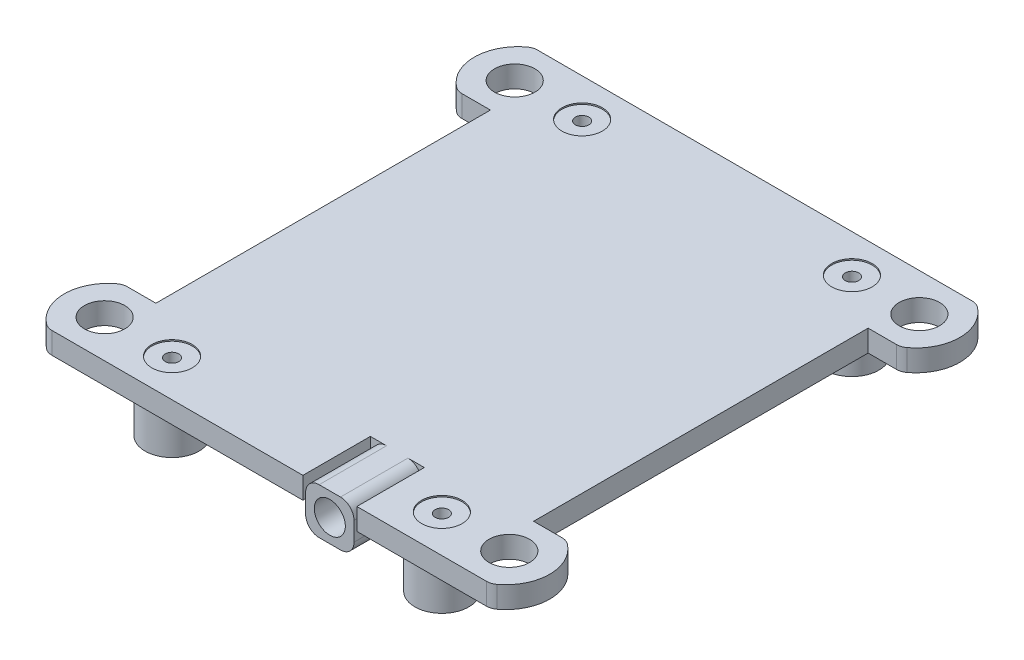
from build123d import *

# Parameters (mm, degrees)
SKETCH1_R            = 1.5
SKETCH1_R_2          = 0.5
BOSS_EXTRUDE1_DEPTH  = 1.6
SKETCH2_R            = 2
SKETCH2_R_2          = 0.5
BOSS_EXTRUDE2_DEPTH  = 3.5
SKETCH3_R            = 1.5
SKETCH3_R_2          = 0.5
CUT_EXTRUDE1_DEPTH   = 0.1
SKETCH4_W            = 2.814940843
SKETCH4_H            = 5
BOSS_EXTRUDE3_DEPTH  = 1.5
SKETCH5_W            = 1.6
SKETCH5_H            = 0.8
BOSS_EXTRUDE4_DEPTH  = 0.5
BOSS_EXTRUDE5_DEPTH  = 2.5
SKETCH7_W            = 13
SKETCH7_H            = 13
BOSS_EXTRUDE6_DEPTH  = 1
SKETCH8_W            = 4
SKETCH8_H            = 1.6
CUT_EXTRUDE2_DEPTH   = 5
BOSS_EXTRUDE8_DEPTH  = 5
SKETCH10_R           = 1.15
CUT_EXTRUDE3_DEPTH   = 4
SKETCH11_W           = 12.6
SKETCH11_H           = 3.3
BOSS_EXTRUDE9_DEPTH  = 5
SKETCH12_W           = 11.6
SKETCH12_H           = 2.3
CUT_EXTRUDE4_DEPTH   = 4
SKETCH13_W           = 0.181198264
SKETCH13_H           = 0.795431403
BOSS_EXTRUDE10_DEPTH = 3.5


with BuildPart() as part:
    # Sketch1 → Boss-Extrude1 (new body)
    with BuildSketch(Plane(origin=(0, 0, 0), x_dir=(1, 0, 0), z_dir=(0, 1, 0))):
        with BuildLine():
            ThreePointArc((16.1, -18), (16.416227766, -17.948683298), (16.7, -17.8))
            ThreePointArc((16.7, -17.8), (18, -15.2), (16.7, -12.6))
            ThreePointArc((16.7, -12.6), (16.416227766, -12.451316702), (16.1, -12.4))
            Line((16.1, -12.4), (14, -12.4))
            Line((14, -12.4), (14, 12.4))
            Line((14, 12.4), (16.1, 12.4))
            ThreePointArc((16.1, 12.4), (16.416227766, 12.451316702), (16.7, 12.6))
            ThreePointArc((16.7, 12.6), (18, 15.2), (16.7, 17.8))
            ThreePointArc((16.7, 17.8), (16.416227766, 17.948683298), (16.1, 18))
            Line((16.1, 18), (-16.1, 18))
            ThreePointArc((-16.1, 18), (-16.416227766, 17.948683298), (-16.7, 17.8))
            ThreePointArc((-16.7, 17.8), (-18, 15.2), (-16.7, 12.6))
            ThreePointArc((-16.7, 12.6), (-16.416227766, 12.451316702), (-16.1, 12.4))
            Line((-16.1, 12.4), (-14, 12.4))
            Line((-14, 12.4), (-14, -12.4))
            Line((-14, -12.4), (-16.1, -12.4))
            ThreePointArc((-16.1, -12.4), (-16.416227766, -12.451316702), (-16.7, -12.6))
            ThreePointArc((-16.7, -12.6), (-18, -15.2), (-16.7, -17.8))
            ThreePointArc((-16.7, -17.8), (-16.416227766, -17.948683298), (-16.1, -18))
            Line((-16.1, -18), (16.1, -18))
        make_face()
        with Locations(Location((-15, 15.2, 0), (0, 0, 270))):
            Circle(SKETCH1_R, mode=Mode.SUBTRACT)
        with Locations(Location((15, 15.2, 0), (0, 0, 270))):
            Circle(SKETCH1_R, mode=Mode.SUBTRACT)
        with Locations(Location((-15, -15.2, 0), (0, 0, 270))):
            Circle(SKETCH1_R, mode=Mode.SUBTRACT)
        with Locations(Location((15, -15.2, 0), (0, 0, 270))):
            Circle(SKETCH1_R, mode=Mode.SUBTRACT)
        with Locations(Location((-10, -15.2, 0), (0, 0, 270))):
            Circle(SKETCH1_R_2, mode=Mode.SUBTRACT)
        with Locations(Location((10, -15.2, 0), (0, 0, 270))):
            Circle(SKETCH1_R_2, mode=Mode.SUBTRACT)
        with Locations(Location((-10, 15.2, 0), (0, 0, 270))):
            Circle(SKETCH1_R_2, mode=Mode.SUBTRACT)
        with Locations(Location((10, 15.2, 0), (0, 0, 270))):
            Circle(SKETCH1_R_2, mode=Mode.SUBTRACT)
    extrude(amount=-BOSS_EXTRUDE1_DEPTH)

    # Sketch2 → Boss-Extrude2 (add)
    # profile 1 of 4: a face of its own
    with BuildSketch(Plane.XZ.offset(1.6)):
        with Locations(Location((-10, 15.2, 0), (0, 0, 270))):
            Circle(SKETCH2_R)
        with Locations(Location((-10, 15.2, 0), (0, 0, 90))):
            Circle(SKETCH2_R_2, mode=Mode.SUBTRACT)
    # profile 2 of 4: a face of its own
    with BuildSketch(Plane.XZ.offset(1.6)):
        with Locations(Location((10, 15.2, 0), (0, 0, 90))):
            Circle(SKETCH2_R)
        with Locations(Location((10, 15.2, 0), (0, 0, 90))):
            Circle(SKETCH2_R_2, mode=Mode.SUBTRACT)
    # profile 3 of 4: a face of its own
    with BuildSketch(Plane.XZ.offset(1.6)):
        with Locations(Location((10, -15.2, 0), (0, 0, 270))):
            Circle(SKETCH2_R)
        with Locations(Location((10, -15.2, 0), (0, 0, 90))):
            Circle(SKETCH2_R_2, mode=Mode.SUBTRACT)
    # profile 4 of 4: a face of its own
    with BuildSketch(Plane.XZ.offset(1.6)):
        with Locations(Location((-10, -15.2, 0), (0, 0, 90))):
            Circle(SKETCH2_R)
        with Locations(Location((-10, -15.2, 0), (0, 0, 90))):
            Circle(SKETCH2_R_2, mode=Mode.SUBTRACT)
    extrude(amount=BOSS_EXTRUDE2_DEPTH)

    # Sketch3 → Cut-Extrude1 (cut)
    # profile 1 of 4: a face of its own
    with BuildSketch(Plane(origin=(0, 0, 0), x_dir=(1, 0, 0), z_dir=(0, 1, 0))):
        with Locations(Location((-10, 15.2, 0), (0, 0, 270))):
            Circle(SKETCH3_R)
        with Locations(Location((-10, 15.2, 0), (0, 0, 270))):
            Circle(SKETCH3_R_2, mode=Mode.SUBTRACT)
    # profile 2 of 4: a face of its own
    with BuildSketch(Plane(origin=(0, 0, 0), x_dir=(1, 0, 0), z_dir=(0, 1, 0))):
        with Locations(Location((10, 15.2, 0), (0, 0, 90))):
            Circle(SKETCH3_R)
        with Locations(Location((10, 15.2, 0), (0, 0, 270))):
            Circle(SKETCH3_R_2, mode=Mode.SUBTRACT)
    # profile 3 of 4: a face of its own
    with BuildSketch(Plane(origin=(0, 0, 0), x_dir=(1, 0, 0), z_dir=(0, 1, 0))):
        with Locations(Location((10, -15.2, 0), (0, 0, 270))):
            Circle(SKETCH3_R)
        with Locations(Location((10, -15.2, 0), (0, 0, 270))):
            Circle(SKETCH3_R_2, mode=Mode.SUBTRACT)
    # profile 4 of 4: a face of its own
    with BuildSketch(Plane(origin=(0, 0, 0), x_dir=(1, 0, 0), z_dir=(0, 1, 0))):
        with Locations(Location((-10, -15.2, 0), (0, 0, 90))):
            Circle(SKETCH3_R)
        with Locations(Location((-10, -15.2, 0), (0, 0, 270))):
            Circle(SKETCH3_R_2, mode=Mode.SUBTRACT)
    extrude(amount=-CUT_EXTRUDE1_DEPTH, mode=Mode.SUBTRACT)

    # Sketch4 → Boss-Extrude3 (add)
    with BuildSketch(Plane.XZ.offset(1.6)):
        with Locations((-12.592529579, 5.5)):
            Rectangle(SKETCH4_W, SKETCH4_H)
    extrude(amount=BOSS_EXTRUDE3_DEPTH)

    # Sketch5 → Boss-Extrude4 (add)
    with BuildSketch(Plane.ZY.offset(14)):
        with Locations((5.5, -2.35)):
            Rectangle(SKETCH5_W, SKETCH5_H)
    extrude(amount=BOSS_EXTRUDE4_DEPTH)

    # Sketch6 → Boss-Extrude5 (add)
    with BuildSketch(Plane.XZ.offset(1.6)):
        with BuildLine():
            Line((-9.180413125, 1.55720135), (-4.680413125, 1.55720135))
            ThreePointArc((-4.680413125, 1.55720135), (-3.973306344, 1.264308131), (-3.680413125, 0.55720135))
            Line((-3.680413125, 0.55720135), (-3.680413125, -3.94279865))
            ThreePointArc((-3.680413125, -3.94279865), (-3.973306344, -4.649905431), (-4.680413125, -4.94279865))
            Line((-4.680413125, -4.94279865), (-9.180413125, -4.94279865))
            ThreePointArc((-9.180413125, -4.94279865), (-9.887519906, -4.649905431), (-10.180413125, -3.94279865))
            Line((-10.180413125, -3.94279865), (-10.180413125, 0.55720135))
            ThreePointArc((-10.180413125, 0.55720135), (-9.887519906, 1.264308131), (-9.180413125, 1.55720135))
        make_face()
    extrude(amount=BOSS_EXTRUDE5_DEPTH)

    # Sketch7 → Boss-Extrude6 (add)
    with BuildSketch(Plane.XZ.offset(1.6)):
        with Locations((4.986452967, -1.419959553)):
            Rectangle(SKETCH7_W, SKETCH7_H)
    extrude(amount=BOSS_EXTRUDE6_DEPTH)

    # Sketch8 → Cut-Extrude2 (cut)
    with BuildSketch(Plane.XY.offset(18)):
        with Locations((4.5, -0.8)):
            Rectangle(SKETCH8_W, SKETCH8_H)
    extrude(amount=-CUT_EXTRUDE2_DEPTH, mode=Mode.SUBTRACT)

    # Sketch9 → Boss-Extrude8 (add)
    with BuildSketch(Plane.XY.offset(13)):
        with BuildLine():
            Line((3.702131482, 0), (5.287124598, 0))
            ThreePointArc((5.287124598, 0), (5.994231379, -0.292893219), (6.287124598, -1))
            Line((6.287124598, -1), (6.287124598, -2.4))
            ThreePointArc((6.287124598, -2.4), (5.994231379, -3.107106781), (5.287124598, -3.4))
            Line((5.287124598, -3.4), (3.702131482, -3.4))
            ThreePointArc((3.702131482, -3.4), (2.995024701, -3.107106781), (2.702131482, -2.4))
            Line((2.702131482, -2.4), (2.702131482, -1))
            ThreePointArc((2.702131482, -1), (2.995024701, -0.292893219), (3.702131482, 0))
        make_face()
    extrude(amount=BOSS_EXTRUDE8_DEPTH)

    # Sketch10 → Cut-Extrude3 (cut)
    with BuildSketch(Plane.XY.offset(18)):
        with Locations((4.49462804, -1.7)):
            Circle(SKETCH10_R)
    extrude(amount=-CUT_EXTRUDE3_DEPTH, mode=Mode.SUBTRACT)

    # Sketch11 → Boss-Extrude9 (add)
    with BuildSketch(Plane(origin=(0, 0, -18), x_dir=(-1, 0, 0), z_dir=(0, 0, -1))):
        with Locations((0, -3.25)):
            Rectangle(SKETCH11_W, SKETCH11_H)
    extrude(amount=-BOSS_EXTRUDE9_DEPTH)

    # Sketch12 → Cut-Extrude4 (cut)
    with BuildSketch(Plane(origin=(0, 0, -18), x_dir=(-1, 0, 0), z_dir=(0, 0, -1))):
        with Locations((0, -3.25)):
            Rectangle(SKETCH12_W, SKETCH12_H)
    extrude(amount=-CUT_EXTRUDE4_DEPTH, mode=Mode.SUBTRACT)

    # Sketch13 → Boss-Extrude10 (add)
    with BuildSketch(Plane(origin=(0, 0, -14), x_dir=(-1, 0, 0), z_dir=(0, 0, -1))):
        with Locations((-5.139752883, -2.609229229)):
            Rectangle(SKETCH13_W, SKETCH13_H)
        with Locations((-3.439752883, -2.609229229)):
            Rectangle(SKETCH13_W, SKETCH13_H)
        with Locations((-1.739752883, -2.609229229)):
            Rectangle(SKETCH13_W, SKETCH13_H)
        with Locations((-0.039752883, -2.609229229)):
            Rectangle(SKETCH13_W, SKETCH13_H)
        with Locations((1.660247117, -2.609229229)):
            Rectangle(SKETCH13_W, SKETCH13_H)
        with Locations((3.360247117, -2.609229229)):
            Rectangle(SKETCH13_W, SKETCH13_H)
        with Locations((5.060247117, -2.609229229)):
            Rectangle(SKETCH13_W, SKETCH13_H)
    extrude(amount=BOSS_EXTRUDE10_DEPTH)


solid = part.part
